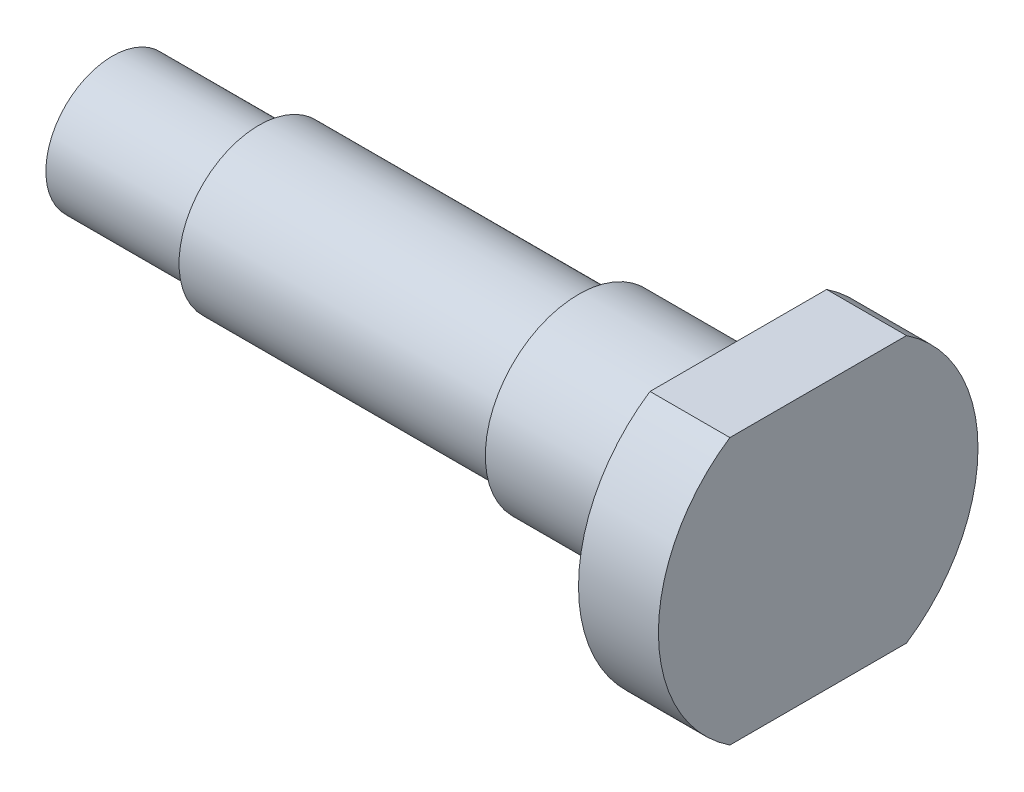
from build123d import *

# Parameters (mm, degrees)
BOSS_EXTRUDE1_DEPTH = 3
BOSS_EXTRUDE2_DEPTH = 18
BOSS_EXTRUDE3_DEPTH = 23.5
BOSS_EXTRUDE4_DEPTH = 6


with BuildPart() as part:
    # Sketch2 → Boss-Extrude1 (new body)
    with BuildSketch(Plane(origin=(0, 0, 0), x_dir=(0, 0, -1), z_dir=(1, 0, 0))):
        with BuildLine():
            Line((3.31662479, 5), (-3.31662479, 5))
            ThreePointArc((-3.31662479, 5), (-5.286764074, 2.837274331), (-6, 0))
            ThreePointArc((-6, 0), (-5.286764074, -2.837274331), (-3.31662479, -5))
            Line((-3.31662479, -5), (3.31662479, -5))
            ThreePointArc((3.31662479, -5), (6, 0), (3.31662479, 5))
        make_face()
    extrude(amount=BOSS_EXTRUDE1_DEPTH)

    # Sketch2<4> → Boss-Extrude2 (add)
    with BuildSketch(Plane(origin=(0, 0, 0), x_dir=(0, 0, -1), z_dir=(1, 0, 0))):
        with BuildLine():
            ThreePointArc((3, 0), (0, 3), (-3, 0))
            ThreePointArc((-3, 0), (0, -3), (3, 0))
        make_face()
        with BuildLine():
            ThreePointArc((2.5, 0), (0, -2.5), (-2.5, 0))
            ThreePointArc((-2.5, 0), (0, 2.5), (2.5, 0))
        make_face(mode=Mode.SUBTRACT)
    extrude(amount=-BOSS_EXTRUDE2_DEPTH)

    # Sketch2<5> → Boss-Extrude3 (add)
    with BuildSketch(Plane(origin=(0, 0, 0), x_dir=(0, 0, -1), z_dir=(1, 0, 0))):
        with BuildLine():
            ThreePointArc((2.5, 0), (0, 2.5), (-2.5, 0))
            ThreePointArc((-2.5, 0), (0, -2.5), (2.5, 0))
        make_face()
    extrude(amount=-BOSS_EXTRUDE3_DEPTH)

    # Sketch2<6> → Boss-Extrude4 (add)
    with BuildSketch(Plane(origin=(0, 0, 0), x_dir=(0, 0, -1), z_dir=(1, 0, 0))):
        with BuildLine():
            ThreePointArc((3.5, 0), (0, 3.5), (-3.5, 0))
            ThreePointArc((-3.5, 0), (0, -3.5), (3.5, 0))
        make_face()
        with BuildLine():
            ThreePointArc((3, 0), (0, -3), (-3, 0))
            ThreePointArc((-3, 0), (0, 3), (3, 0))
        make_face(mode=Mode.SUBTRACT)
    extrude(amount=-BOSS_EXTRUDE4_DEPTH)


solid = part.part
